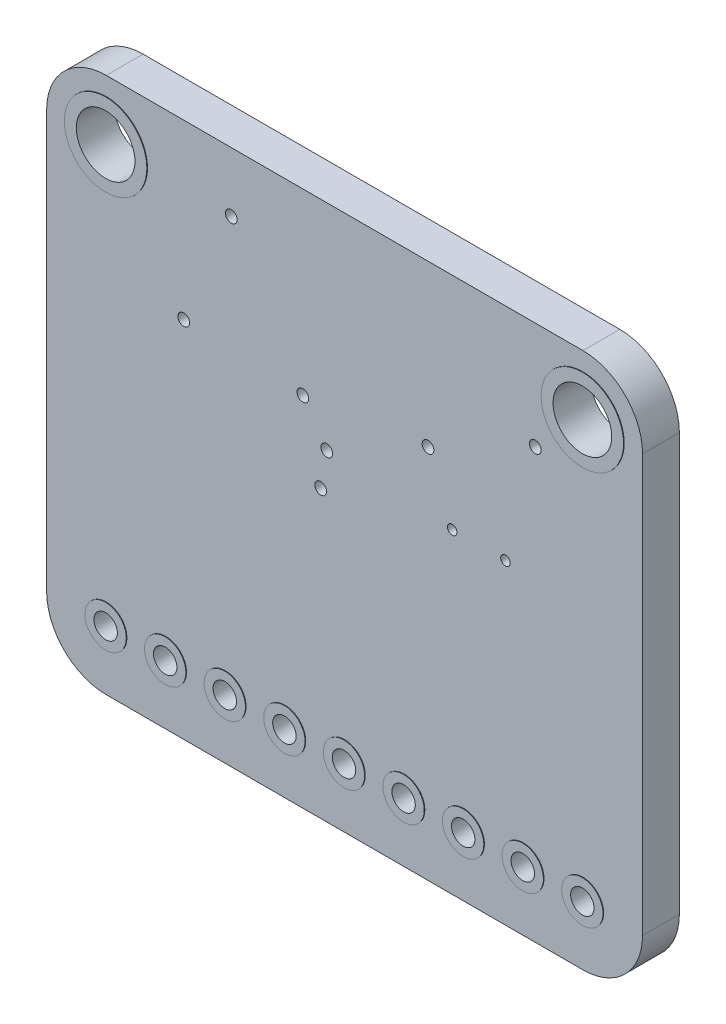
from build123d import *

# Parameters (mm, degrees)
SKETCH1_R           = 0.5
SKETCH1_R_2         = 0.25
SKETCH1_R_3         = 0.203
SKETCH1_R_4         = 1.25
BOSS_EXTRUDE1_DEPTH = 1.57
SKETCH2_R           = 1.758
SKETCH2_R_2         = 1.25
BOSS_EXTRUDE2_DEPTH = 0.0254
SKETCH3_R           = 0.881
SKETCH3_R_2         = 0.5
BOSS_EXTRUDE3_DEPTH = 0.0254


with BuildPart() as part:
    # Sketch1 → Boss-Extrude1 (new body)
    with BuildSketch(Plane(origin=(0, 0, 0), x_dir=(-1, 0, 0), z_dir=(0, 0, -1))):
        with BuildLine():
            Line((-22.86, 0), (-2.54, 0))
            ThreePointArc((-2.54, 0), (-0.743948776, 0.743948776), (0, 2.54))
            Line((0, 2.54), (0, 20.32))
            ThreePointArc((0, 20.32), (-0.743948776, 22.116051224), (-2.54, 22.86))
            Line((-2.54, 22.86), (-22.86, 22.86))
            ThreePointArc((-22.86, 22.86), (-24.656051224, 22.116051224), (-25.4, 20.32))
            Line((-25.4, 20.32), (-25.4, 2.54))
            ThreePointArc((-25.4, 2.54), (-24.656051224, 0.743948776), (-22.86, 0))
        make_face()
        with Locations(Location((-22.86, 2.54, 0), (0, 0, 180))):
            Circle(SKETCH1_R, mode=Mode.SUBTRACT)
        with Locations(Location((-17.78, 2.54, 0), (0, 0, 180))):
            Circle(SKETCH1_R, mode=Mode.SUBTRACT)
        with Locations(Location((-12.7, 2.54, 0), (0, 0, 180))):
            Circle(SKETCH1_R, mode=Mode.SUBTRACT)
        with Locations(Location((-7.62, 2.54, 0), (0, 0, 180))):
            Circle(SKETCH1_R, mode=Mode.SUBTRACT)
        with Locations(Location((-2.54, 2.54, 0), (0, 0, 180))):
            Circle(SKETCH1_R, mode=Mode.SUBTRACT)
        with Locations(Location((-7.874, 20.32, 0), (0, 0, 180))):
            Circle(SKETCH1_R_2, mode=Mode.SUBTRACT)
        with Locations(Location((-10.922, 15.24, 0), (0, 0, 180))):
            Circle(SKETCH1_R_2, mode=Mode.SUBTRACT)
        with Locations(Location((-11.684, 12.192, 0), (0, 0, 180))):
            Circle(SKETCH1_R_2, mode=Mode.SUBTRACT)
        with Locations(Location((-17.285, 13.462, 0), (0, 0, 180))):
            Circle(SKETCH1_R_3, mode=Mode.SUBTRACT)
        with Locations(Location((-20.828, 18.288, 0), (0, 0, 180))):
            Circle(SKETCH1_R_2, mode=Mode.SUBTRACT)
        with Locations(Location((-5.842, 15.494, 0), (0, 0, 180))):
            Circle(SKETCH1_R_2, mode=Mode.SUBTRACT)
        with Locations(Location((-16.256, 16.002, 0), (0, 0, 180))):
            Circle(SKETCH1_R_2, mode=Mode.SUBTRACT)
        with Locations(Location((-19.558, 13.462, 0), (0, 0, 180))):
            Circle(SKETCH1_R_3, mode=Mode.SUBTRACT)
        with Locations(Location((-11.938, 13.716, 0), (0, 0, 180))):
            Circle(SKETCH1_R_2, mode=Mode.SUBTRACT)
        with Locations(Location((-2.54, 20.32, 0), (0, 0, 180))):
            Circle(SKETCH1_R_4, mode=Mode.SUBTRACT)
        with Locations(Location((-22.86, 20.32, 0), (0, 0, 180))):
            Circle(SKETCH1_R_4, mode=Mode.SUBTRACT)
        with Locations(Location((-5.08, 2.54, 0), (0, 0, 180))):
            Circle(SKETCH1_R, mode=Mode.SUBTRACT)
        with Locations(Location((-10.16, 2.54, 0), (0, 0, 180))):
            Circle(SKETCH1_R, mode=Mode.SUBTRACT)
        with Locations(Location((-15.24, 2.54, 0), (0, 0, 180))):
            Circle(SKETCH1_R, mode=Mode.SUBTRACT)
        with Locations(Location((-20.32, 2.54, 0), (0, 0, 180))):
            Circle(SKETCH1_R, mode=Mode.SUBTRACT)
    extrude(amount=-BOSS_EXTRUDE1_DEPTH)

    # Sketch2 → Boss-Extrude2 (add)
    # profile 1 of 2: a face of its own
    with BuildSketch(Plane.XY.offset(1.57)):
        with Locations(Location((2.54, 20.32, 0), (0, 0, 180))):
            Circle(SKETCH2_R)
        with Locations((2.54, 20.32)):
            Circle(SKETCH2_R_2, mode=Mode.SUBTRACT)
    # profile 2 of 2: a face of its own
    with BuildSketch(Plane.XY.offset(1.57)):
        with Locations(Location((22.86, 20.32, 0), (0, 0, 180))):
            Circle(SKETCH2_R)
        with Locations((22.86, 20.32)):
            Circle(SKETCH2_R_2, mode=Mode.SUBTRACT)
    boss_extrude2 = extrude(amount=BOSS_EXTRUDE2_DEPTH)

    # Mirror1: Boss-Extrude2 across plane
    add(boss_extrude2.mirror(Plane.XY.offset(0.785)))

    # Sketch3 → Boss-Extrude3 (add)
    # profile 1 of 9: a face of its own
    with BuildSketch(Plane.XY.offset(1.57)):
        with Locations(Location((2.54, 2.54, 0), (0, 0, 180))):
            Circle(SKETCH3_R)
        with Locations((2.54, 2.54)):
            Circle(SKETCH3_R_2, mode=Mode.SUBTRACT)
    # profile 2 of 9: a face of its own
    with BuildSketch(Plane.XY.offset(1.57)):
        with Locations(Location((5.08, 2.54, 0), (0, 0, 180))):
            Circle(SKETCH3_R)
        with Locations((5.08, 2.54)):
            Circle(SKETCH3_R_2, mode=Mode.SUBTRACT)
    # profile 3 of 9: a face of its own
    with BuildSketch(Plane.XY.offset(1.57)):
        with Locations(Location((7.62, 2.54, 0), (0, 0, 180))):
            Circle(SKETCH3_R)
        with Locations((7.62, 2.54)):
            Circle(SKETCH3_R_2, mode=Mode.SUBTRACT)
    # profile 4 of 9: a face of its own
    with BuildSketch(Plane.XY.offset(1.57)):
        with Locations(Location((10.16, 2.54, 0), (0, 0, 180))):
            Circle(SKETCH3_R)
        with Locations((10.16, 2.54)):
            Circle(SKETCH3_R_2, mode=Mode.SUBTRACT)
    # profile 5 of 9: a face of its own
    with BuildSketch(Plane.XY.offset(1.57)):
        with Locations(Location((12.7, 2.54, 0), (0, 0, 180))):
            Circle(SKETCH3_R)
        with Locations((12.7, 2.54)):
            Circle(SKETCH3_R_2, mode=Mode.SUBTRACT)
    # profile 6 of 9: a face of its own
    with BuildSketch(Plane.XY.offset(1.57)):
        with Locations(Location((15.24, 2.54, 0), (0, 0, 180))):
            Circle(SKETCH3_R)
        with Locations((15.24, 2.54)):
            Circle(SKETCH3_R_2, mode=Mode.SUBTRACT)
    # profile 7 of 9: a face of its own
    with BuildSketch(Plane.XY.offset(1.57)):
        with Locations(Location((17.78, 2.54, 0), (0, 0, 180))):
            Circle(SKETCH3_R)
        with Locations((17.78, 2.54)):
            Circle(SKETCH3_R_2, mode=Mode.SUBTRACT)
    # profile 8 of 9: a face of its own
    with BuildSketch(Plane.XY.offset(1.57)):
        with Locations(Location((20.32, 2.54, 0), (0, 0, 180))):
            Circle(SKETCH3_R)
        with Locations((20.32, 2.54)):
            Circle(SKETCH3_R_2, mode=Mode.SUBTRACT)
    # profile 9 of 9: a face of its own
    with BuildSketch(Plane.XY.offset(1.57)):
        with Locations(Location((22.86, 2.54, 0), (0, 0, 180))):
            Circle(SKETCH3_R)
        with Locations((22.86, 2.54)):
            Circle(SKETCH3_R_2, mode=Mode.SUBTRACT)
    boss_extrude3 = extrude(amount=BOSS_EXTRUDE3_DEPTH)

    # Mirror2: Boss-Extrude3 across plane
    add(boss_extrude3.mirror(Plane.XY.offset(0.785)))


solid = part.part
